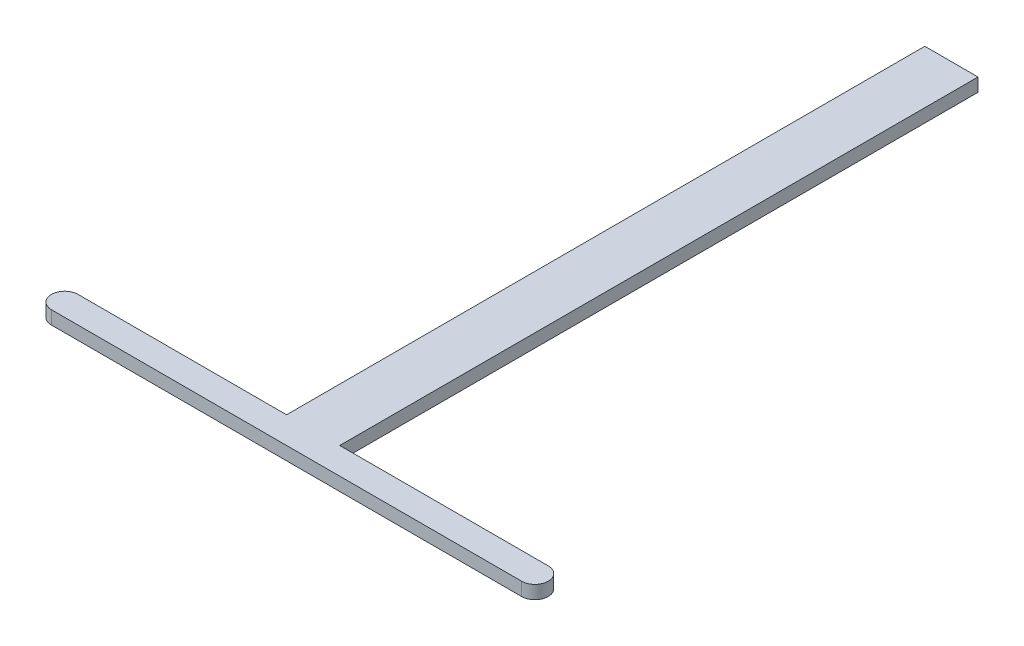
from build123d import *

# Parameters (mm, degrees)
BOSS_EXTRUDE1_DEPTH = 3.175


with BuildPart() as part:
    # Sketch1 → Boss-Extrude1 (new body)
    with BuildSketch(Plane(origin=(0, 0, 0), x_dir=(1, 0, 0), z_dir=(0, 1, 0))):
        with BuildLine():
            Line((-6.35, 0), (-56.134, 0))
            ThreePointArc((-56.134, 0), (-59.309, -3.175), (-56.134, -6.35))
            Line((-56.134, -6.35), (56.134, -6.35))
            ThreePointArc((56.134, -6.35), (59.309, -3.175), (56.134, 0))
            Line((56.134, 0), (6.35, 0))
            Line((6.35, 0), (6.35, 152.4))
            Line((6.35, 152.4), (-6.35, 152.4))
            Line((-6.35, 152.4), (-6.35, 0))
        make_face()
    extrude(amount=BOSS_EXTRUDE1_DEPTH)


solid = part.part
